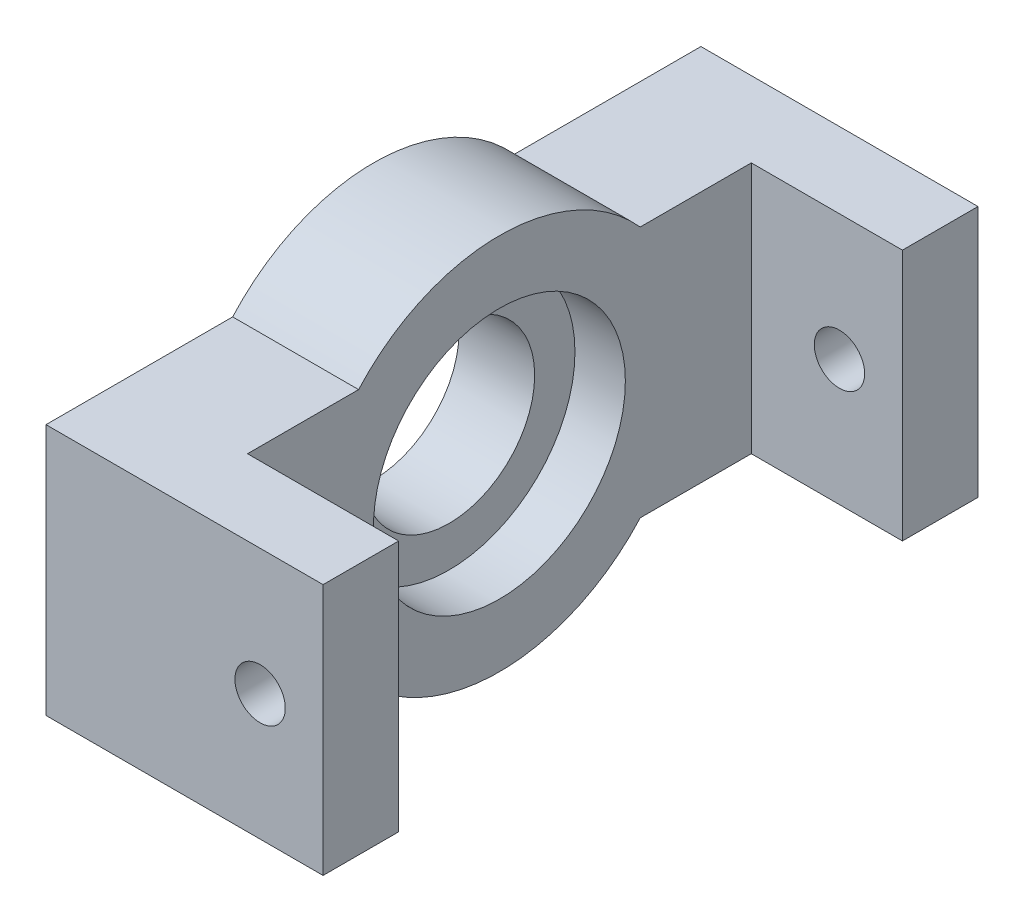
from build123d import *

# Parameters (mm, degrees)
SKETCH_1_R          = 7.5
EXTRUDE_1_DEPTH     = 5
SKETCH_2_R          = 5
CUT_EXTRUDE_1_DEPTH = 2
SKETCH_3_R          = 3.4
CUT_EXTRUDE_2_DEPTH = 12.022703843
SKETCH_4_W          = 7.409830056
SKETCH_4_H          = 10
EXTRUDE_3_DEPTH     = 5
SKETCH_5_W          = 3
SKETCH_5_H          = 10
EXTRUDE_4_DEPTH     = 6
SKETCH_6_R          = 1
CUT_EXTRUDE_3_DEPTH = 30.210443338


with BuildPart() as part:
    # 草图1 → 凸台-拉伸1 (new body)
    with BuildSketch(Plane(origin=(0, 0, 0), x_dir=(0, 0, -1), z_dir=(1, 0, 0))):
        Circle(SKETCH_1_R)
    extrude(amount=EXTRUDE_1_DEPTH)

    # 草图2 → 切除-拉伸1 (cut)
    with BuildSketch(Plane(origin=(5, 0, 0), x_dir=(0, 0, -1), z_dir=(1, 0, 0))):
        Circle(SKETCH_2_R)
    extrude(amount=-CUT_EXTRUDE_1_DEPTH, mode=Mode.SUBTRACT)

    # 草图3 → 切除-拉伸2 (cut, through all)
    with BuildSketch(Plane(origin=(3, 0, 0), x_dir=(0, 0, -1), z_dir=(1, 0, 0))):
        Circle(SKETCH_3_R)
    extrude(amount=-CUT_EXTRUDE_2_DEPTH, mode=Mode.SUBTRACT)

    # 草图4 → 凸台-拉伸3 (add)
    with BuildSketch(Plane(origin=(5, 0, 0), x_dir=(0, 0, -1), z_dir=(1, 0, 0))):
        with Locations((9.295084972, 0)):
            Rectangle(SKETCH_4_W, SKETCH_4_H)
        with Locations((-9.295084972, 0)):
            Rectangle(SKETCH_4_W, SKETCH_4_H)
    extrude(amount=-EXTRUDE_3_DEPTH)

    # 草图5 → 凸台-拉伸4 (add)
    with BuildSketch(Plane(origin=(5, 0, 0), x_dir=(0, 0, -1), z_dir=(1, 0, 0))):
        with Locations((11.5, 0)):
            Rectangle(SKETCH_5_W, SKETCH_5_H)
        with Locations((-11.5, 0)):
            Rectangle(SKETCH_5_W, SKETCH_5_H)
    extrude(amount=EXTRUDE_4_DEPTH)

    # 草图6 → 切除-拉伸3 (cut, through all)
    with BuildSketch(Plane(origin=(0, 0, -13), x_dir=(-1, 0, 0), z_dir=(0, 0, -1))):
        with Locations((-8.5, 0)):
            Circle(SKETCH_6_R)
    extrude(amount=-CUT_EXTRUDE_3_DEPTH, mode=Mode.SUBTRACT)


solid = part.part
